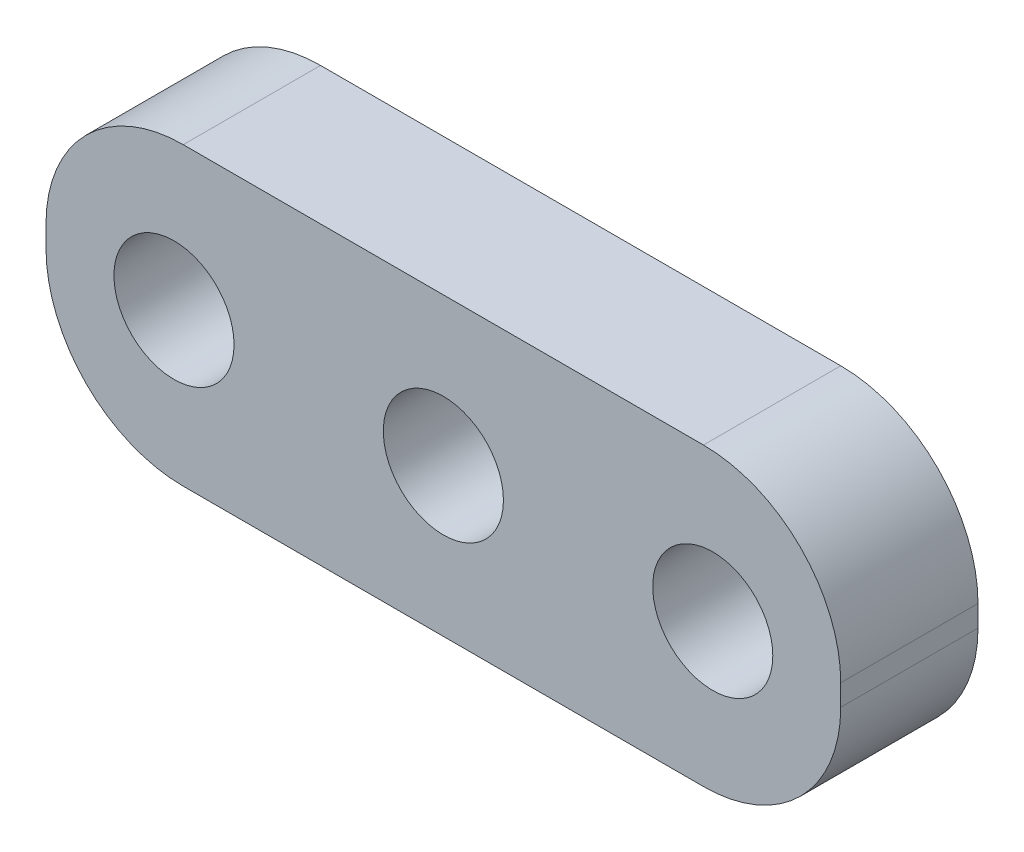
from build123d import *

# Parameters (mm, degrees)
SKETCH1_W           = 23.16
SKETCH1_H           = 8.62
SKETCH1_R           = 1.75
BOSS_EXTRUDE1_DEPTH = 4
FILLET1_R           = 4


with BuildPart() as part:
    # Sketch1 → Boss-Extrude1 (new body)
    with BuildSketch(Plane.XY):
        Rectangle(SKETCH1_W, SKETCH1_H)
        with Locations((-7.85, 0)):
            Circle(SKETCH1_R, mode=Mode.SUBTRACT)
        with Locations((7.85, 0)):
            Circle(SKETCH1_R, mode=Mode.SUBTRACT)
        Circle(SKETCH1_R, mode=Mode.SUBTRACT)
    extrude(amount=BOSS_EXTRUDE1_DEPTH)

    # Fillet1
    fillet1_edges = [part.edges().sort_by_distance(p)[0] for p in [
        (11.58, -4.31, 2),
        (-11.58, -4.31, 2),
        (-11.58, 4.31, 2),
        (11.58, 4.31, 2),
    ]]
    fillet(fillet1_edges, radius=FILLET1_R)


solid = part.part
